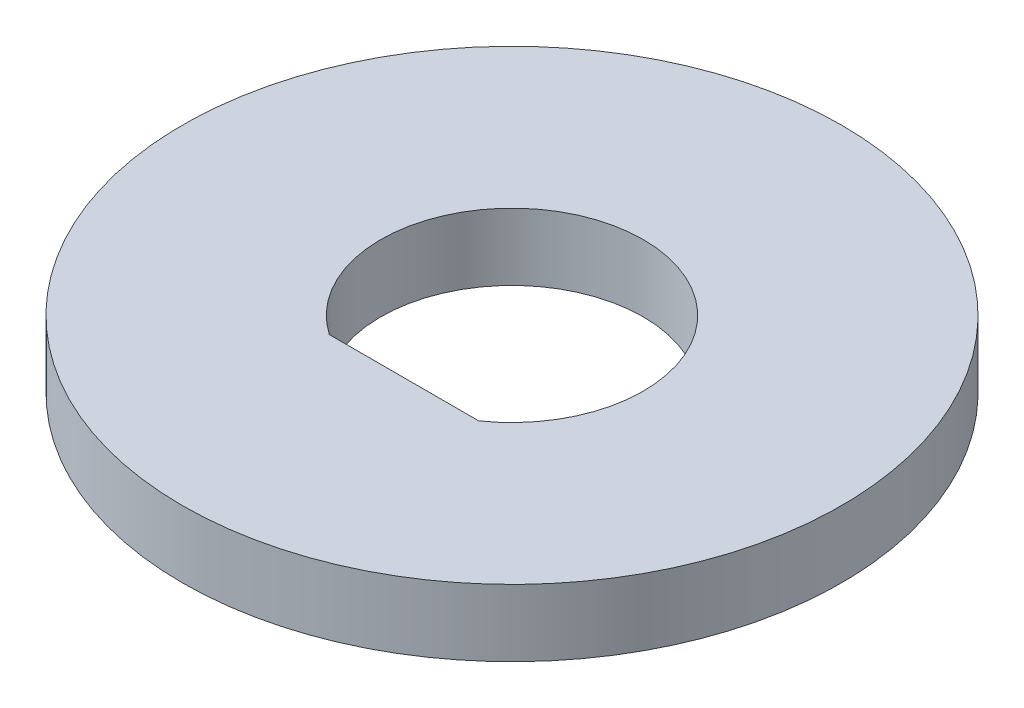
from build123d import *

# Parameters (mm, degrees)
SKETCH_1_R      = 12.8
EXTRUDE_1_DEPTH = 2.6


with BuildPart() as part:
    # 草图1 → 凸台-拉伸1 (new body)
    with BuildSketch(Plane(origin=(0, 0, 0), x_dir=(1, 0, 0), z_dir=(0, 1, 0))):
        with Locations(Location((0, 0, 0), (0, 0, 270))):
            Circle(SKETCH_1_R)
        with BuildLine():
            Line((-2.9, -4.195235393), (2.9, -4.195235393))
            ThreePointArc((2.9, -4.195235393), (0, 5.1), (-2.9, -4.195235393))
        make_face(mode=Mode.SUBTRACT)
    extrude(amount=EXTRUDE_1_DEPTH)


solid = part.part
